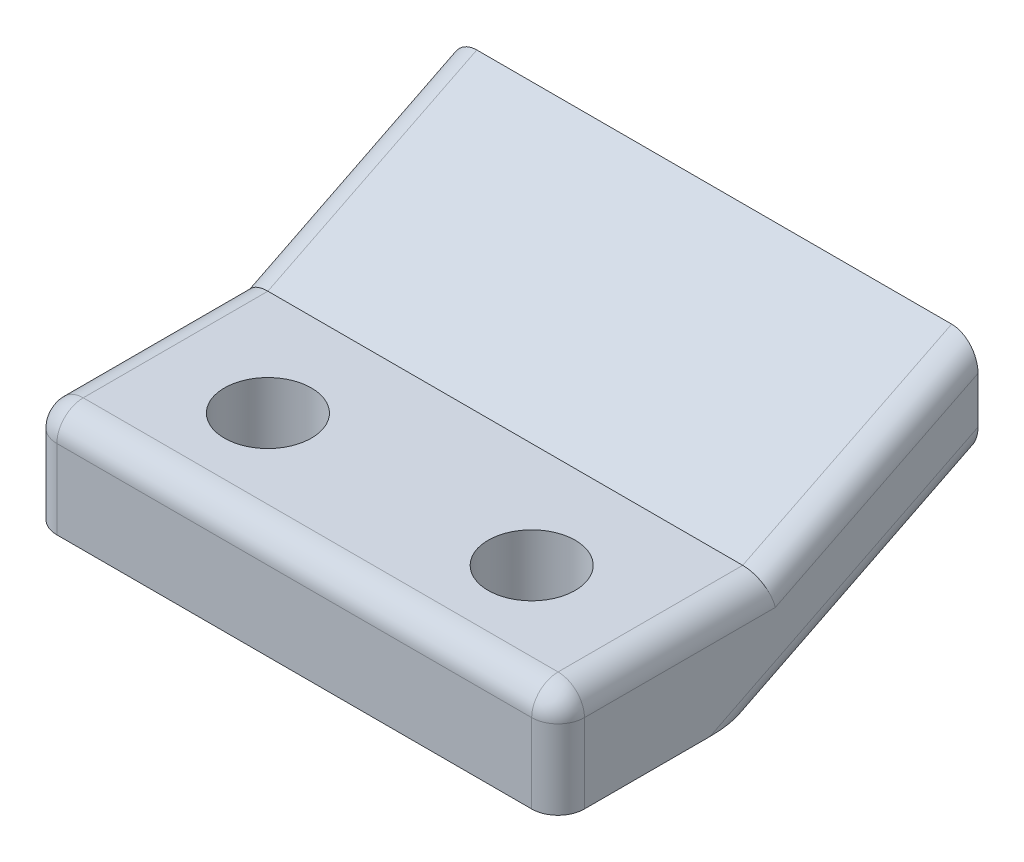
from build123d import *

# Parameters (mm, degrees)
RESSALTO_EXTRUS_O2_DEPTH = 20
ESBO_O6_W                = 20
ESBO_O6_H                = 8
RESSALTO_EXTRUS_O3_DEPTH = 4
ESBO_O5_R                = 1.65
CORTE_EXTRUS_O2_DEPTH    = 27.773270252
FILETE1_R                = 1


with BuildPart() as part:
    # Esboço4 → Ressalto-extrusão2 (new body)
    with BuildSketch(Plane(origin=(0, 0, 0), x_dir=(0, 0, -1), z_dir=(1, 0, 0))):
        Polygon((0, 0), (15.92, 7.96), (15.92, 3.96), (8, 0), align=None)
    extrude(amount=RESSALTO_EXTRUS_O2_DEPTH)

    # Esboço6 → Ressalto-extrusão3 (add)
    with BuildSketch(Plane.XZ):
        with Locations((10, -4)):
            Rectangle(ESBO_O6_W, ESBO_O6_H)
    extrude(amount=-RESSALTO_EXTRUS_O3_DEPTH)

    # Esboço5 → Corte-extrusão2 (cut, through all)
    with BuildSketch(Plane.XZ):
        with Locations(Location((5, -4, 0), (0, 0, 270))):
            Circle(ESBO_O5_R)
        with Locations(Location((15, -4, 0), (0, 0, 270))):
            Circle(ESBO_O5_R)
    extrude(amount=-CORTE_EXTRUS_O2_DEPTH, mode=Mode.SUBTRACT)

    # Filete1
    filete1_edges = [part.edges().sort_by_distance(p)[0] for p in [
        (20, 5.98, -11.96),
        (0, 4, -4),
        (20, 4, -4),
        (20, 2, 0),
        (10, 4, 0),
        (0, 2, 0),
        (0, 5.98, -11.96),
        (0, 1.98, -11.96),
        (20, 1.98, -11.96),
    ]]
    fillet(filete1_edges, radius=FILETE1_R)


solid = part.part
